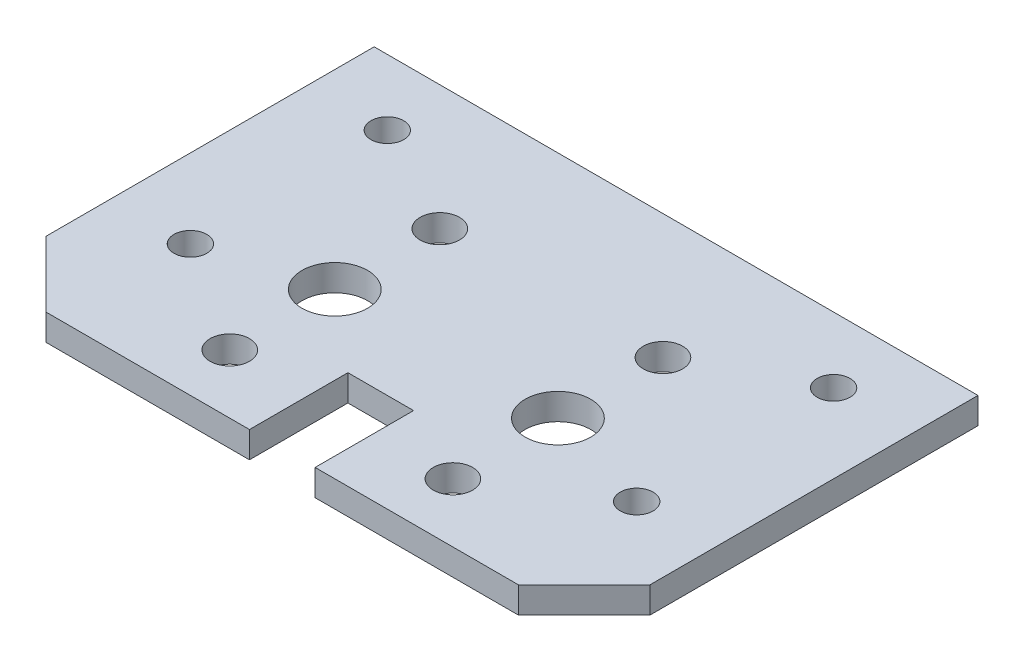
from build123d import *

# Parameters (mm, degrees)
SKETCH_1_W          = 92
SKETCH_1_H          = 60
SKETCH_1_R          = 2.5
SKETCH_1_R_2        = 5
SKETCH_1_R_3        = 3
EXTRUDE_1_DEPTH     = 4
SKETCH_2_W          = 10
SKETCH_2_H          = 15
CUT_EXTRUDE_1_DEPTH = 10
CUT_EXTRUDE_2_DEPTH = 4


with BuildPart() as part:
    # Эскиз1 → Бобышка-Вытянуть1 (new body)
    with BuildSketch(Plane(origin=(0, 0, 0), x_dir=(1, 0, 0), z_dir=(0, 1, 0))):
        with Locations((46, 30)):
            Rectangle(SKETCH_1_W, SKETCH_1_H)
        with Locations(Location((12, 50, 0), (0, 0, 270))):
            Circle(SKETCH_1_R, mode=Mode.SUBTRACT)
        with Locations(Location((12, 20, 0), (0, 0, 270))):
            Circle(SKETCH_1_R, mode=Mode.SUBTRACT)
        with Locations(Location((80, 50, 0), (0, 0, 270))):
            Circle(SKETCH_1_R, mode=Mode.SUBTRACT)
        with Locations(Location((80, 20, 0), (0, 0, 270))):
            Circle(SKETCH_1_R, mode=Mode.SUBTRACT)
        with Locations(Location((29, 25, 0), (0, 0, 270))):
            Circle(SKETCH_1_R_2, mode=Mode.SUBTRACT)
        with Locations(Location((63, 25, 0), (0, 0, 270))):
            Circle(SKETCH_1_R_2, mode=Mode.SUBTRACT)
        with Locations(Location((29, 41, 0), (0, 0, 270))):
            Circle(SKETCH_1_R_3, mode=Mode.SUBTRACT)
        with Locations(Location((29, 9, 0), (0, 0, 270))):
            Circle(SKETCH_1_R_3, mode=Mode.SUBTRACT)
        with Locations(Location((63, 41, 0), (0, 0, 270))):
            Circle(SKETCH_1_R_3, mode=Mode.SUBTRACT)
        with Locations(Location((63, 9, 0), (0, 0, 270))):
            Circle(SKETCH_1_R_3, mode=Mode.SUBTRACT)
    extrude(amount=EXTRUDE_1_DEPTH)

    # Эскиз2 → Вырез-Вытянуть1 (cut)
    with BuildSketch(Plane(origin=(0, 4, 0), x_dir=(1, 0, 0), z_dir=(0, 1, 0))):
        with Locations((46, 7.5)):
            Rectangle(SKETCH_2_W, SKETCH_2_H)
    extrude(amount=-CUT_EXTRUDE_1_DEPTH, mode=Mode.SUBTRACT)

    # Эскиз3 → Вырез-Вытянуть2 (cut)
    with BuildSketch(Plane(origin=(0, 4, 0), x_dir=(1, 0, 0), z_dir=(0, 1, 0))):
        Polygon((10, 0), (0, 10), (0, 0), align=None)
        Polygon((92, 0), (92, 10), (82, 0), align=None)
    extrude(amount=-CUT_EXTRUDE_2_DEPTH, mode=Mode.SUBTRACT)


solid = part.part
